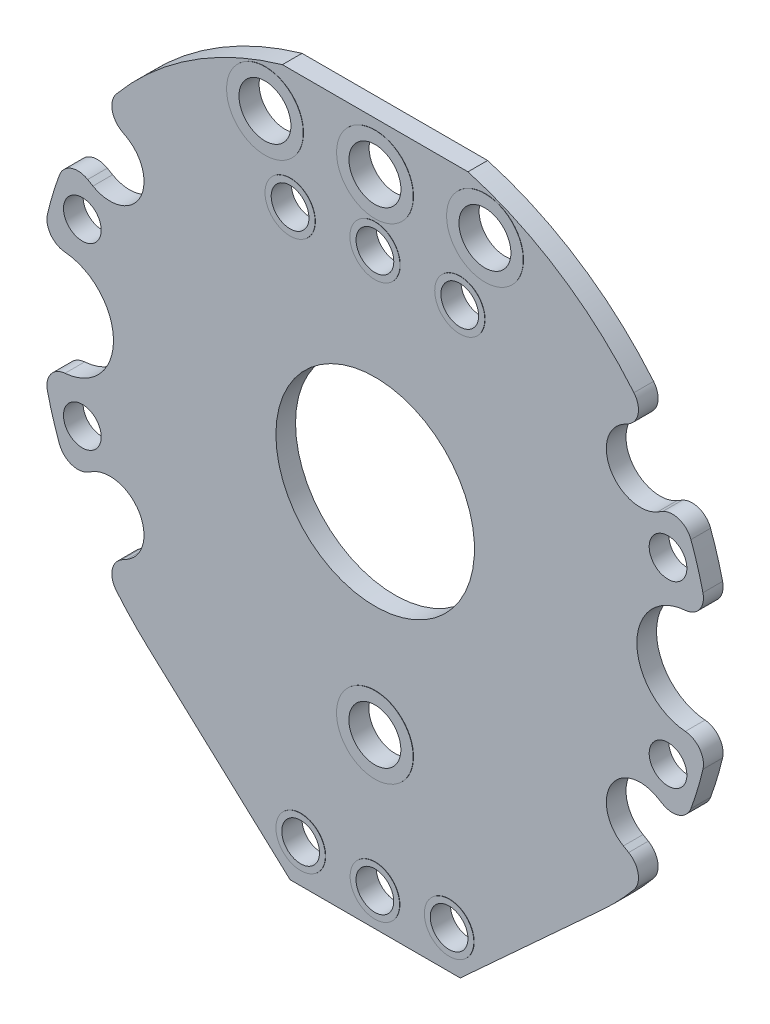
from build123d import *
from build123d.topology import SkipClean

# Parameters (mm, degrees)
BOSS_EXTRUDE1_DEPTH            = 1.5875
CUT_EXTRUDE1_DEPTH             = 46.864987723
CUT_EXTRUDE2_DEPTH             = 46.864987723
CUT_EXTRUDE3_DEPTH             = 46.864987723
CUT_EXTRUDE4_DEPTH             = 46.864987723
SKETCH6_W                      = 3.0988
SKETCH6_H                      = 0.0254
SKETCH10_W                     = 2
SKETCH10_H                     = 0.0254
M14_CLEARANCE_HOLE1_D          = 16.05
M14_CLEARANCE_HOLE1_DEPTH      = 1.6129
F_8_5_8_5_DIAMETER_HOLE1_D     = 8.5
F_8_5_8_5_DIAMETER_HOLE2_D     = 8.5
F_8_5_8_5_DIAMETER_HOLE2_DEPTH = 1.6129
SKETCH17_W                     = 2
SKETCH17_H                     = 0.0254
M2_5_CLEARANCE_HOLE1_D         = 3.048
M3_5_CLEARANCE_HOLE1_D         = 4.2
CHAMFER1_SIZE                  = 9.324286844
FILLET1_R                      = 1.5875
BOSS_EXTRUDE2_START            = 0.02
SKETCH30_R                     = 3.1
SKETCH30_R_2                   = 2.1
BOSS_EXTRUDE2_DEPTH            = 0.02
SKETCH31_R                     = 2.025
SKETCH31_R_2                   = 1.525
BOSS_EXTRUDE3_DEPTH            = 0.0207
SKETCH32_R                     = 1.525
CUT_EXTRUDE6_DEPTH             = 41.528319577
BOSS_EXTRUDE4_START            = 0.0254
SKETCH33_R                     = 2
SKETCH33_R_2                   = 1.524
BOSS_EXTRUDE4_DEPTH            = 0.0254
SKETCH34_R                     = 2
CUT_EXTRUDE8_DEPTH             = 0.0254
CUT_EXTRUDE9_START             = -0.0254
SKETCH36_R                     = 2
CUT_EXTRUDE9_DEPTH             = 0.0254
BOSS_EXTRUDE5_START            = 0.0254
SKETCH37_R                     = 2
SKETCH37_R_2                   = 1.524
BOSS_EXTRUDE5_DEPTH            = 0.0254
SKETCH38_R                     = 2
SKETCH38_R_2                   = 1.524
BOSS_EXTRUDE6_DEPTH            = 0.02


with BuildPart() as part:
    # Sketch1 → Boss-Extrude1 (new body)
    with BuildSketch(Plane(origin=(0, 0, -0.79375), x_dir=(-1, 0, 0), z_dir=(0, 0, -1))):
        with BuildLine():
            Line((-18.376844344, -20.054806456), (0, -36.894081809))
            Line((0, -36.894081809), (18.376844344, -20.054806456))
            ThreePointArc((18.376844344, -20.054806456), (26.47733416, 6.233333445), (7.5, 26.146771695))
            Line((7.5, 26.146771695), (-7.5, 26.146771695))
            ThreePointArc((-7.5, 26.146771695), (-26.47733416, 6.233333445), (-18.376844344, -20.054806456))
        make_face()
    extrude(amount=-BOSS_EXTRUDE1_DEPTH)

    # Sketch2 → Cut-Extrude1 (cut, through all)
    with BuildSketch(Plane.XY.offset(0.79375)):
        with BuildLine():
            Line((-25.071320917, 11.2995074), (-22.809128744, 9.99343014))
            ThreePointArc((-22.809128744, 9.99343014), (-19.052558883, 11), (-20.059128744, 14.75656986))
            Line((-20.059128744, 14.75656986), (-22.321320917, 16.062647121))
            ThreePointArc((-22.321320917, 16.062647121), (-23.815698604, 13.75), (-25.071320917, 11.2995074))
        make_face()
    extrude(amount=-CUT_EXTRUDE1_DEPTH, mode=Mode.SUBTRACT)

    # Sketch3 → Cut-Extrude2 (cut, through all)
    with BuildSketch(Plane.XY.offset(0.79375)):
        with BuildLine():
            Line((22.321320917, 16.062647121), (20.059128744, 14.75656986))
            ThreePointArc((20.059128744, 14.75656986), (19.052558883, 11), (22.809128744, 9.99343014))
            Line((22.809128744, 9.99343014), (25.071320917, 11.2995074))
            ThreePointArc((25.071320917, 11.2995074), (23.815698604, 13.75), (22.321320917, 16.062647121))
        make_face()
    extrude(amount=-CUT_EXTRUDE2_DEPTH, mode=Mode.SUBTRACT)

    # Sketch4 → Cut-Extrude3 (cut, through all)
    with BuildSketch(Plane.XY.offset(0.79375)):
        with BuildLine():
            Line((25.071320917, -11.2995074), (22.809128744, -9.99343014))
            ThreePointArc((22.809128744, -9.99343014), (19.052558883, -11), (20.059128744, -14.75656986))
            Line((20.059128744, -14.75656986), (22.321320917, -16.062647121))
            ThreePointArc((22.321320917, -16.062647121), (23.815698604, -13.75), (25.071320917, -11.2995074))
        make_face()
    extrude(amount=-CUT_EXTRUDE3_DEPTH, mode=Mode.SUBTRACT)

    # Sketch5 → Cut-Extrude4 (cut, through all)
    with BuildSketch(Plane.XY.offset(0.79375)):
        with BuildLine():
            Line((-22.321320917, -16.062647121), (-20.059128744, -14.75656986))
            ThreePointArc((-20.059128744, -14.75656986), (-19.052558883, -11), (-22.809128744, -9.99343014))
            Line((-22.809128744, -9.99343014), (-25.071320917, -11.2995074))
            ThreePointArc((-25.071320917, -11.2995074), (-23.815698604, -13.75), (-22.321320917, -16.062647121))
        make_face()
    extrude(amount=-CUT_EXTRUDE4_DEPTH, mode=Mode.SUBTRACT)

    # Sketch6 → Revolve1 (revolve)
    with BuildSketch(Plane.XZ.offset(17), mode=Mode.PRIVATE) as revolve1_sk:
        with Locations((1.5494, 0.80645)):
            Rectangle(SKETCH6_W, SKETCH6_H)
    revolve(revolve1_sk.sketch.rotate(Axis((0, -17, 0.81915), (0, 0, -1)), 180), axis=Axis((0, -17, 0.81915), (0, 0, -1)))

    # Sketch10 → Revolve5 (revolve)
    with BuildSketch(Plane.XZ.offset(28.575), mode=Mode.PRIVATE) as revolve5_sk:
        with Locations((1, 0.80645)):
            Rectangle(SKETCH10_W, SKETCH10_H)
    revolve(revolve5_sk.sketch.rotate(Axis((0, -28.575, 0.81915), (0, 0, -1)), 180), axis=Axis((0, -28.575, 0.81915), (0, 0, -1)))

    # M14 Clearance Hole1
    with Locations(Plane(origin=(0, 0, -0.79375), x_dir=(-1, 0, 0), z_dir=(0, 0, -1))):
        with Locations((0, 0)):
            Hole(M14_CLEARANCE_HOLE1_D / 2, depth=M14_CLEARANCE_HOLE1_DEPTH)

    # Ø8.5 (8.5) Diameter Hole1 (through all)
    with Locations(Plane.XY.offset(0.79375)):
        with Locations((-25.4, 0)):
            Hole(F_8_5_8_5_DIAMETER_HOLE1_D / 2)

    # Ø8.5 (8.5) Diameter Hole2
    with Locations(Plane(origin=(0, 0, -0.79375), x_dir=(-1, 0, 0), z_dir=(0, 0, -1))):
        with Locations((-25.4, 0)):
            Hole(F_8_5_8_5_DIAMETER_HOLE2_D / 2, depth=F_8_5_8_5_DIAMETER_HOLE2_DEPTH)

    # Sketch17 → Revolve12 (revolve)
    with BuildSketch(Plane.XZ.offset(28.575), mode=Mode.PRIVATE) as revolve12_sk:
        with Locations((1, -0.80645)):
            Rectangle(SKETCH17_W, SKETCH17_H)
    revolve(revolve12_sk.sketch.rotate(Axis((0, -28.575, -0.79375), (0, 0, -1)), 180), axis=Axis((0, -28.575, -0.79375), (0, 0, -1)))

    # M2.5 Clearance Hole1 (through all)
    with Locations(Plane(origin=(0, 0, -0.81915), x_dir=(-1, 0, 0), z_dir=(0, 0, -1))):
        with Locations((0, -27.9), (-6, -27.5), (6, -27.5), (23.66854271, 7.236199692), (23.66854271, -7.236199692), (-23.66854271, -7.236199692), (-23.66854271, 7.236199692)):
            Hole(M2_5_CLEARANCE_HOLE1_D / 2)

    # M3.5 Clearance Hole1 (through all)
    with Locations(Plane(origin=(0, 0, -0.79375), x_dir=(-1, 0, 0), z_dir=(0, 0, -1))):
        with Locations((-8.89, 22.225), (8.89, 22.225), (0, 22.225), (0, -17)):
            Hole(M3_5_CLEARANCE_HOLE1_D / 2)

    # Chamfer1
    chamfer1_edges = [part.edges().sort_by_distance(p)[0] for p in [
        (0, -36.894081809, 0),
    ]]
    chamfer(chamfer1_edges, length=CHAMFER1_SIZE)

    # Fillet1
    fillet1_edges = [part.edges().sort_by_distance(p)[0] for p in [
        (-26.909471851, 3.972907591, 0),
        (-26.909471851, -3.972907591, 0),
        (26.909471851, -3.972907591, 0),
        (26.909471851, 3.972907591, 0),
        (-22.061208685, 15.912471254, 0),
        (-24.811208685, 11.149331533, 0),
        (24.811208685, 11.149331533, 0),
        (22.061208685, 15.912471254, 0),
        (22.061208685, -15.912471254, 0),
        (24.811208685, -11.149331533, 0),
        (-24.811208685, -11.149331533, 0),
        (-22.061208685, -15.912471254, 0),
    ]]
    fillet(fillet1_edges, radius=FILLET1_R)

    # Sketch30 → Boss-Extrude2 (add)
    # profile 1 of 3: a face of its own
    with BuildSketch(Plane.XY.offset(0.79375).offset(BOSS_EXTRUDE2_START)):
        with Locations(Location((-8.89, 22.225, 0), (0, 0, 180))):
            Circle(SKETCH30_R)
        with Locations(Location((-8.89, 22.225, 0), (0, 0, 180))):
            Circle(SKETCH30_R_2, mode=Mode.SUBTRACT)
    # profile 2 of 3: a face of its own
    with BuildSketch(Plane.XY.offset(0.79375).offset(BOSS_EXTRUDE2_START)):
        with Locations(Location((0, 22.225, 0), (0, 0, 180))):
            Circle(SKETCH30_R)
        with Locations(Location((0, 22.225, 0), (0, 0, 180))):
            Circle(SKETCH30_R_2, mode=Mode.SUBTRACT)
    # profile 3 of 3: a face of its own
    with BuildSketch(Plane.XY.offset(0.79375).offset(BOSS_EXTRUDE2_START)):
        with Locations(Location((8.89, 22.225, 0), (0, 0, 180))):
            Circle(SKETCH30_R)
        with Locations(Location((8.89, 22.225, 0), (0, 0, 180))):
            Circle(SKETCH30_R_2, mode=Mode.SUBTRACT)
    boss_extrude2 = extrude(amount=-BOSS_EXTRUDE2_DEPTH)

    # Mirror1: Boss-Extrude2 across plane
    add(boss_extrude2.mirror(Plane.XY))

    # Sketch31 → Boss-Extrude3 (add)
    # profile 1 of 3: a face of its own
    with BuildSketch(Plane.XY.offset(0.79375)):
        with Locations(Location((-6.858, 16.510000001, 0), (0, 0, 180))):
            Circle(SKETCH31_R)
        with Locations((-6.858, 16.510000001)):
            Circle(SKETCH31_R_2, mode=Mode.SUBTRACT)
    # profile 2 of 3: a face of its own
    with BuildSketch(Plane.XY.offset(0.79375)):
        with Locations(Location((0, 16.881256527, 0), (0, 0, 180))):
            Circle(SKETCH31_R)
        with Locations((0, 16.881256527)):
            Circle(SKETCH31_R_2, mode=Mode.SUBTRACT)
    # profile 3 of 3: a face of its own
    with BuildSketch(Plane.XY.offset(0.79375)):
        with Locations(Location((6.858, 16.510000001, 0), (0, 0, 180))):
            Circle(SKETCH31_R)
        with Locations((6.858, 16.510000001)):
            Circle(SKETCH31_R_2, mode=Mode.SUBTRACT)
    boss_extrude3 = extrude(amount=BOSS_EXTRUDE3_DEPTH)

    # Sketch32 → Cut-Extrude6 (cut, through all)
    with BuildSketch(Plane.XY.offset(0.79375)):
        with Locations(Location((6.858, 16.510000001, 0), (0, 0, 180))):
            Circle(SKETCH32_R)
        with Locations(Location((0, 16.881256527, 0), (0, 0, 180))):
            Circle(SKETCH32_R)
        with Locations(Location((-6.858, 16.510000001, 0), (0, 0, 180))):
            Circle(SKETCH32_R)
    extrude(amount=-CUT_EXTRUDE6_DEPTH, mode=Mode.SUBTRACT)

    # Mirror2: Boss-Extrude3 across plane
    add(boss_extrude3.mirror(Plane.XY))

    # Sketch33 → Boss-Extrude4 (add)
    # profile 1 of 2: a face of its own
    with BuildSketch(Plane.XY.offset(0.79375).offset(BOSS_EXTRUDE4_START)):
        with Locations(Location((-6, -27.5, 0), (0, 0, 180))):
            Circle(SKETCH33_R)
        with Locations(Location((-6, -27.5, 0), (0, 0, 180))):
            Circle(SKETCH33_R_2, mode=Mode.SUBTRACT)
    # profile 2 of 2: a face of its own
    with BuildSketch(Plane.XY.offset(0.79375).offset(BOSS_EXTRUDE4_START)):
        with Locations(Location((6, -27.5, 0), (0, 0, 180))):
            Circle(SKETCH33_R)
        with Locations(Location((6, -27.5, 0), (0, 0, 180))):
            Circle(SKETCH33_R_2, mode=Mode.SUBTRACT)
    extrude(amount=-BOSS_EXTRUDE4_DEPTH)

    # Sketch34 → Cut-Extrude8 (cut)
    with BuildSketch(Plane(origin=(0, 0, 0.81915), x_dir=(-1, 0, 0), z_dir=(0, 0, -1))):
        with Locations((0, -28.575)):
            Circle(SKETCH34_R)
    extrude(amount=CUT_EXTRUDE8_DEPTH, mode=Mode.SUBTRACT)

    # Sketch36 → Cut-Extrude9 (cut)
    with BuildSketch(Plane(origin=(0, 0, -0.81915), x_dir=(-1, 0, 0), z_dir=(0, 0, -1)).offset(CUT_EXTRUDE9_START)):
        with Locations((0, -28.575)):
            Circle(SKETCH36_R)
    extrude(amount=CUT_EXTRUDE9_DEPTH, mode=Mode.SUBTRACT)

    # Sketch37 → Boss-Extrude5 (add)
    with BuildSketch(Plane.XY.offset(0.79375).offset(BOSS_EXTRUDE5_START)):
        with Locations(Location((0, -27.9, 0), (0, 0, 180))):
            Circle(SKETCH37_R)
        with Locations(Location((0, -27.9, 0), (0, 0, 180))):
            Circle(SKETCH37_R_2, mode=Mode.SUBTRACT)
    extrude(amount=-BOSS_EXTRUDE5_DEPTH)

    # Sketch38 → Boss-Extrude6 (add)
    # profile 1 of 3: a face of its own
    with SkipClean():  # the faces are left unmerged after this step: merging them gives an invalid solid
        with BuildSketch(Plane(origin=(0, 0, -0.79375), x_dir=(-1, 0, 0), z_dir=(0, 0, -1))):
            with Locations((0, -27.9)):
                Circle(SKETCH38_R)
            with Locations((0, -27.9)):
                Circle(SKETCH38_R_2, mode=Mode.SUBTRACT)
        # profile 2 of 3: a face of its own
        with BuildSketch(Plane(origin=(0, 0, -0.79375), x_dir=(-1, 0, 0), z_dir=(0, 0, -1))):
            with Locations((6, -27.5)):
                Circle(SKETCH38_R)
            with Locations((6, -27.5)):
                Circle(SKETCH38_R_2, mode=Mode.SUBTRACT)
        # profile 3 of 3: a face of its own
        with BuildSketch(Plane(origin=(0, 0, -0.79375), x_dir=(-1, 0, 0), z_dir=(0, 0, -1))):
            with Locations((-6, -27.5)):
                Circle(SKETCH38_R)
            with Locations((-6, -27.5)):
                Circle(SKETCH38_R_2, mode=Mode.SUBTRACT)
        extrude(amount=BOSS_EXTRUDE6_DEPTH)


solid = part.part
